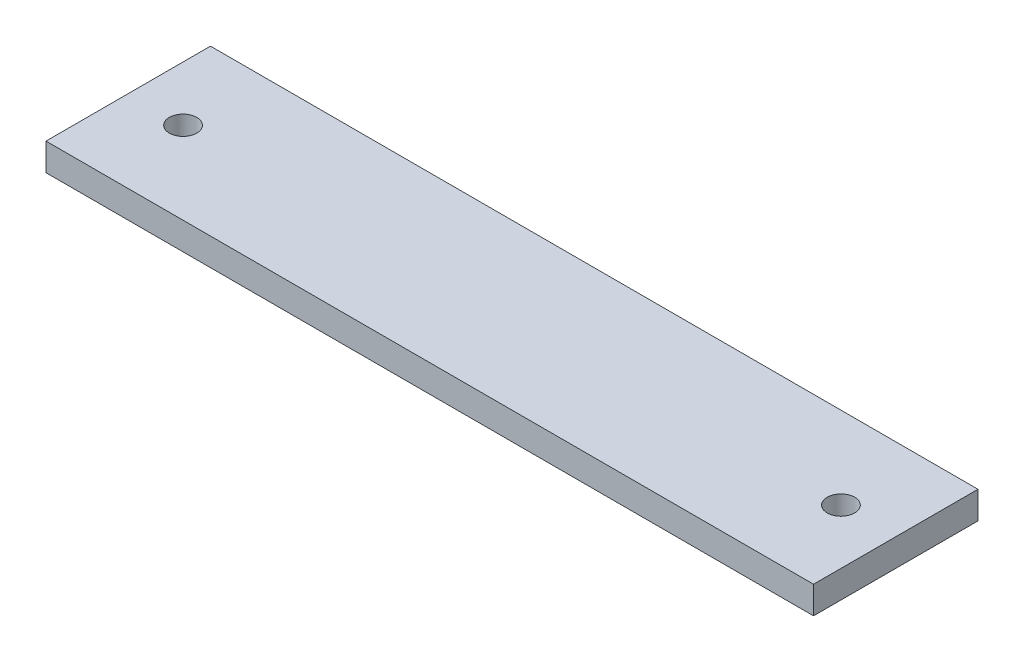
from build123d import *

# Parameters (mm, degrees)
SKETCH1_W           = 140
SKETCH1_H           = 30
SKETCH1_R           = 2.5
BOSS_EXTRUDE1_DEPTH = 5


with BuildPart() as part:
    # Sketch1 → Boss-Extrude1 (new body)
    with BuildSketch(Plane(origin=(0, 0, 0), x_dir=(1, 0, 0), z_dir=(0, 1, 0))):
        with Locations((3.14516129, 1.572580645)):
            Rectangle(SKETCH1_W, SKETCH1_H)
        with Locations(Location((-56.85483871, 1.572580645, 0), (0, 0, 270))):
            Circle(SKETCH1_R, mode=Mode.SUBTRACT)
        with Locations(Location((63.14516129, 1.572580645, 0), (0, 0, 90))):
            Circle(SKETCH1_R, mode=Mode.SUBTRACT)
    extrude(amount=BOSS_EXTRUDE1_DEPTH)


solid = part.part
